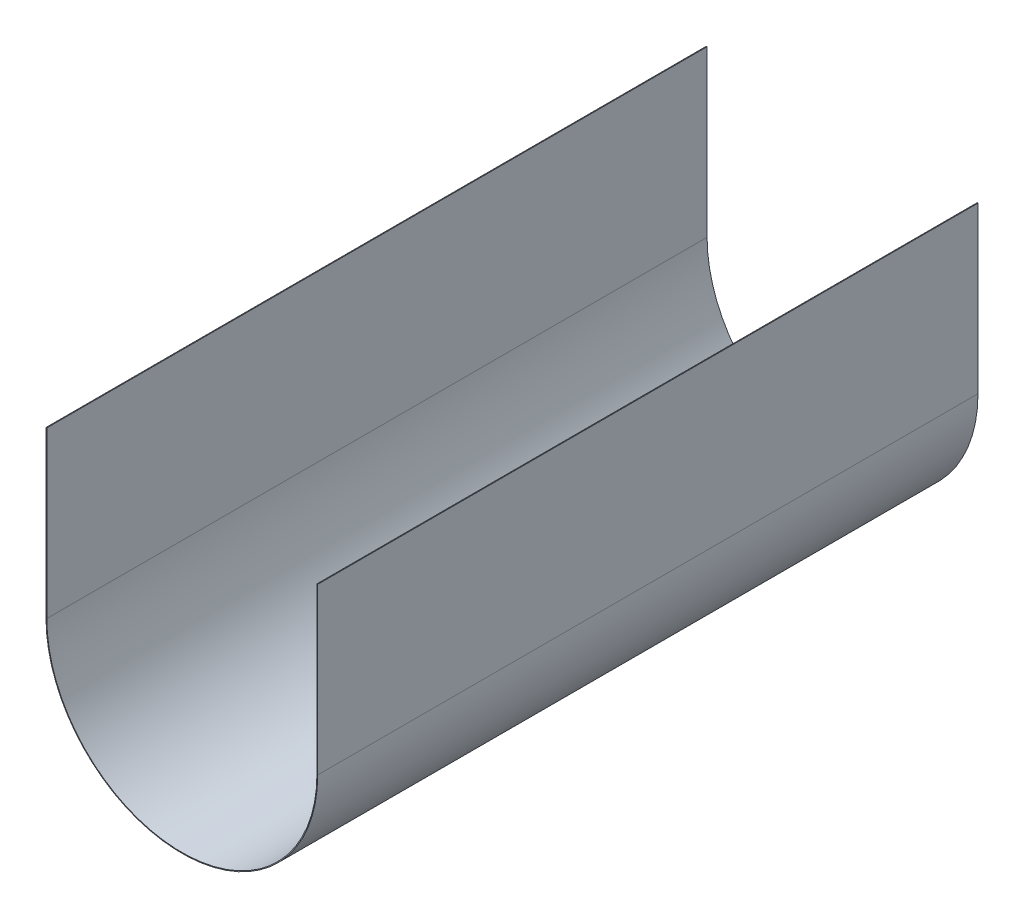
from build123d import *

# Parameters (mm, degrees)
BOSS_EXTRUDE1_DEPTH = 1676.4


with BuildPart() as part:
    # Sketch1 → Boss-Extrude1 (new body)
    with BuildSketch(Plane.XY):
        with BuildLine():
            Line((-344.9, 0), (-344.9, 419.1))
            Line((-344.9, 419.1), (-342.9, 419.1))
            Line((-342.9, 419.1), (-342.9, 0))
            ThreePointArc((-342.9, 0), (0, -342.9), (342.9, 0))
            Line((342.9, 0), (342.9, 419.1))
            Line((342.9, 419.1), (344.9, 419.1))
            Line((344.9, 419.1), (344.9, 0))
            ThreePointArc((344.9, 0), (0, -344.9), (-344.9, 0))
        make_face()
    extrude(amount=BOSS_EXTRUDE1_DEPTH)


solid = part.part
